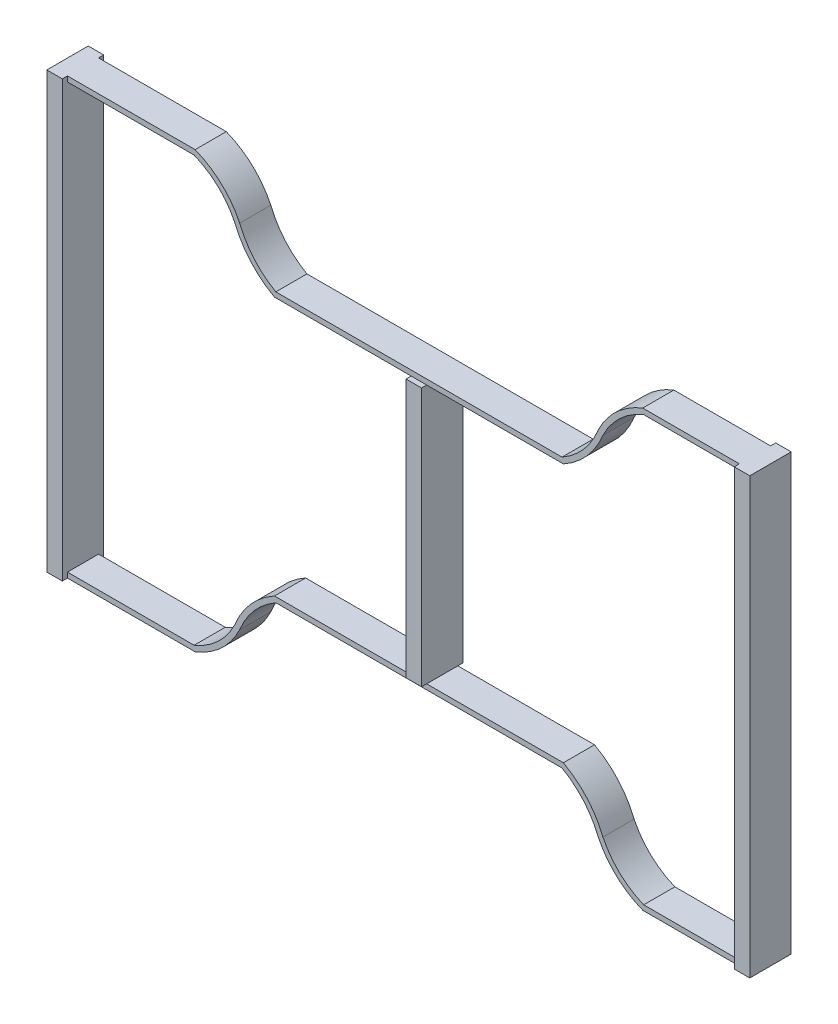
from build123d import *

# Parameters (mm, degrees)
BOSS_EXTRUDE1_DEPTH   = 9.55
BOSS_EXTRUDE1_2_DEPTH = 9.55
SKETCH2_W             = 9.5
SKETCH2_H             = 266.7
SKETCH2_W_2           = 4.75
SKETCH2_H_2           = 158.7
BOSS_EXTRUDE2_DEPTH   = 12.7


with BuildPart() as part:
    # Sketch1 → Boss-Extrude1 (new, symmetric)
    with BuildSketch(Plane.XY):
        with BuildLine():
            Line((87.8, 266.7), (9.5, 266.7))
            Line((9.5, 266.7), (9.5, 263.5))
            Line((9.5, 263.5), (87.185653041, 263.5))
            ThreePointArc((87.185653041, 263.5), (101.872730764, 254.086326296), (112.181844193, 240.013313649))
            ThreePointArc((112.181844193, 240.013313649), (121.93402425, 224.242253512), (136.446354787, 212.7))
            Line((136.446354787, 212.7), (313.604913576, 212.7))
            ThreePointArc((313.604913576, 212.7), (328.117244113, 224.242253512), (337.86942417, 240.013313649))
            ThreePointArc((337.86942417, 240.013313649), (348.178537599, 254.086326296), (362.865615322, 263.5))
            Line((362.865615322, 263.5), (421.551268364, 263.5))
            Line((421.551268364, 263.5), (421.551268364, 266.7))
            Line((421.551268364, 266.7), (362.251268364, 266.7))
            ThreePointArc((362.251268364, 266.7), (346.178913489, 256.597493698), (334.937565202, 241.3))
            ThreePointArc((334.937565202, 241.3), (326.024834919, 226.70817797), (312.775634182, 215.9))
            Line((312.775634182, 215.9), (137.275634182, 215.9))
            ThreePointArc((137.275634182, 215.9), (124.026433444, 226.70817797), (115.113703162, 241.3))
            ThreePointArc((115.113703162, 241.3), (103.872354874, 256.597493698), (87.8, 266.7))
        make_face()
    extrude(amount=BOSS_EXTRUDE1_DEPTH, both=True)



with BuildPart() as body_2:
    # Sketch1 → Boss-Extrude1 2 (new, symmetric)
    with BuildSketch(Plane.XY):
        with BuildLine():
            Line((87.185653041, 3.2), (9.5, 3.2))
            Line((9.5, 3.2), (9.5, 0))
            Line((9.5, 0), (87.8, 0))
            ThreePointArc((87.8, 0), (103.872354874, 10.102506302), (115.113703162, 25.4))
            ThreePointArc((115.113703162, 25.4), (124.026433444, 39.99182203), (137.275634182, 50.8))
            Line((137.275634182, 50.8), (312.775634182, 50.8))
            ThreePointArc((312.775634182, 50.8), (326.024834919, 39.99182203), (334.937565202, 25.4))
            ThreePointArc((334.937565202, 25.4), (346.178913489, 10.102506302), (362.251268364, 0))
            Line((362.251268364, 0), (421.551268364, 0))
            Line((421.551268364, 0), (421.551268364, 3.2))
            Line((421.551268364, 3.2), (362.865615322, 3.2))
            ThreePointArc((362.865615322, 3.2), (348.178537599, 12.613673704), (337.86942417, 26.686686351))
            ThreePointArc((337.86942417, 26.686686351), (328.117244113, 42.457746488), (313.604913576, 54))
            Line((313.604913576, 54), (136.446354787, 54))
            ThreePointArc((136.446354787, 54), (121.93402425, 42.457746488), (112.181844193, 26.686686351))
            ThreePointArc((112.181844193, 26.686686351), (101.872730764, 12.613673704), (87.185653041, 3.2))
        make_face()
    extrude(amount=BOSS_EXTRUDE1_2_DEPTH, both=True)


with BuildPart() as part_1:
    add(part.part)

    add(body_2.part)  # Boss-Extrude2 merges body 2
    # Sketch2 → Boss-Extrude2 (add, symmetric)
    with BuildSketch(Plane.XY):
        with Locations((4.75, 133.35)):
            Rectangle(SKETCH2_W, SKETCH2_H)
        with Locations((222.650634182, 133.35)):
            Rectangle(SKETCH2_W_2, SKETCH2_H_2)
        with Locations((227.400634182, 133.35)):
            Rectangle(SKETCH2_W_2, SKETCH2_H_2)
        with Locations((426.301268364, 133.35)):
            Rectangle(SKETCH2_W, SKETCH2_H)
    extrude(amount=BOSS_EXTRUDE2_DEPTH, both=True)


solid = part_1.part
